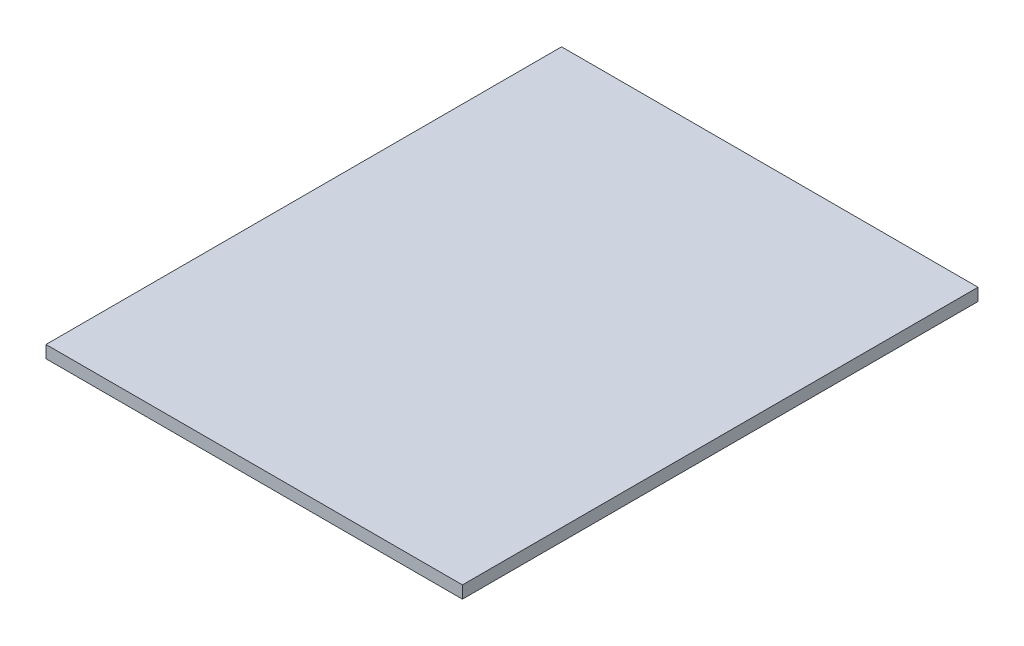
from build123d import *

# Parameters (mm, degrees)
SKETCH1_W           = 21
SKETCH1_H           = 26
BOSS_EXTRUDE1_DEPTH = 0.625


with BuildPart() as part:
    # Sketch1 → Boss-Extrude1 (new body)
    with BuildSketch(Plane(origin=(0, 0, 0), x_dir=(1, 0, 0), z_dir=(0, 1, 0))):
        with Locations((10.5, 13)):
            Rectangle(SKETCH1_W, SKETCH1_H)
    extrude(amount=BOSS_EXTRUDE1_DEPTH)


solid = part.part
